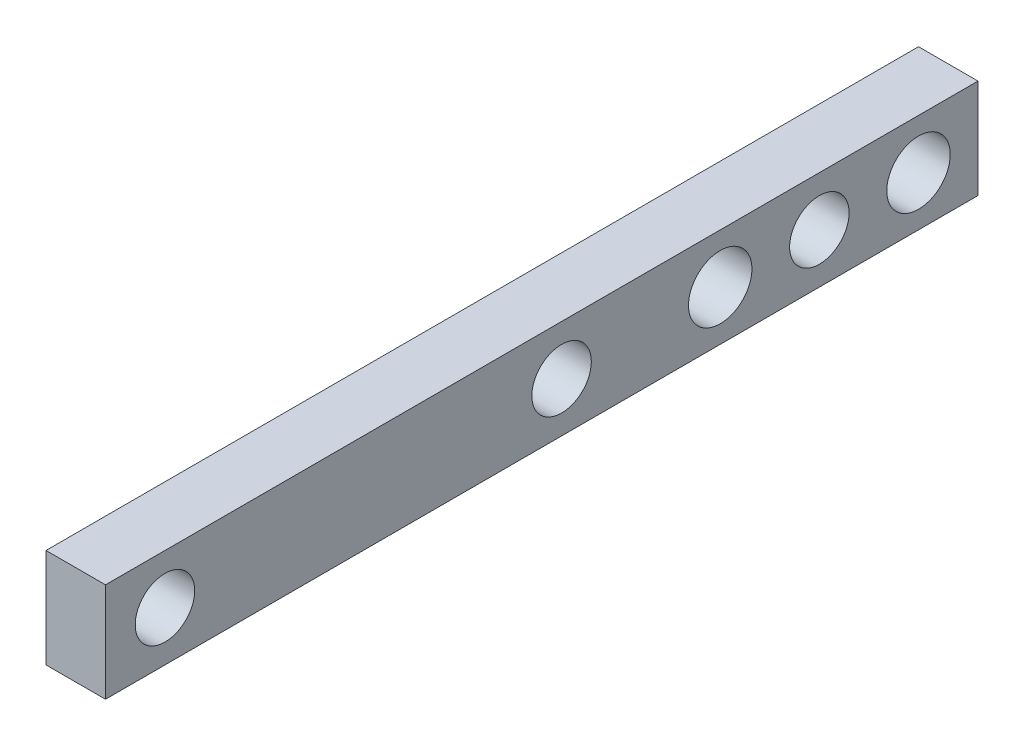
from build123d import *

# Parameters (mm, degrees)
SKETCH2_W           = 44
SKETCH2_H           = 5
SKETCH2_R           = 1.6
SKETCH2_R_2         = 1.5
BOSS_EXTRUDE1_DEPTH = 3
SKETCH3_R           = 1.5
CUT_EXTRUDE1_DEPTH  = 23.343902972


with BuildPart() as part:
    # Sketch2 → Boss-Extrude1 (new body)
    with BuildSketch(Plane(origin=(0, 0, 0), x_dir=(0, 0, -1), z_dir=(1, 0, 0))):
        Rectangle(SKETCH2_W, SKETCH2_H)
        with Locations((19, 0)):
            Circle(SKETCH2_R, mode=Mode.SUBTRACT)
        with Locations((9, 0)):
            Circle(SKETCH2_R, mode=Mode.SUBTRACT)
        with Locations((1, 0)):
            Circle(SKETCH2_R_2, mode=Mode.SUBTRACT)
        with Locations((-19, 0)):
            Circle(SKETCH2_R_2, mode=Mode.SUBTRACT)
    extrude(amount=BOSS_EXTRUDE1_DEPTH)

    # Sketch3 → Cut-Extrude1 (cut, through all)
    with BuildSketch(Plane(origin=(3, 0, 0), x_dir=(0, 0, -1), z_dir=(1, 0, 0))):
        with Locations((14, 0)):
            Circle(SKETCH3_R)
    extrude(amount=-CUT_EXTRUDE1_DEPTH, mode=Mode.SUBTRACT)


solid = part.part
